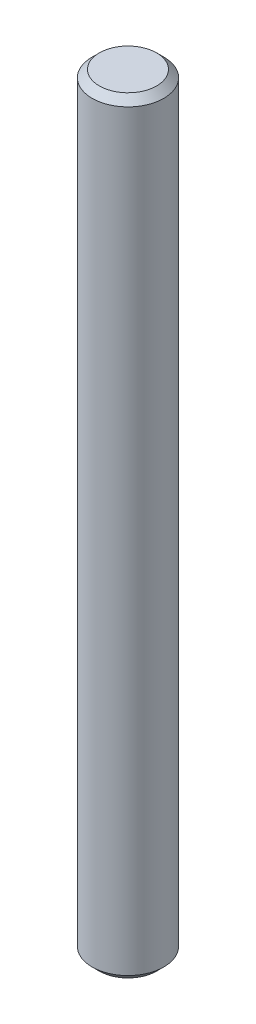
from build123d import *

# Parameters (mm, degrees)
SKETCH_1_R      = 2.5
EXTRUDE_1_DEPTH = 53.5
CHAMFER_1_SIZE  = 0.5


with BuildPart() as part:
    # Эскиз1 → Бобышка-Вытянуть1 (new body)
    with BuildSketch(Plane(origin=(0, 0, 0), x_dir=(1, 0, 0), z_dir=(0, 1, 0))):
        with Locations(Location((0, 0, 0), (0, 0, 270))):
            Circle(SKETCH_1_R)
    extrude(amount=EXTRUDE_1_DEPTH)

    # Фаска1
    chamfer_1_edges = [part.edges().sort_by_distance(p)[0] for p in [
        (0, 0, -2.5),
        (0, 53.5, -2.5),
    ]]
    chamfer(chamfer_1_edges, length=CHAMFER_1_SIZE)


solid = part.part
